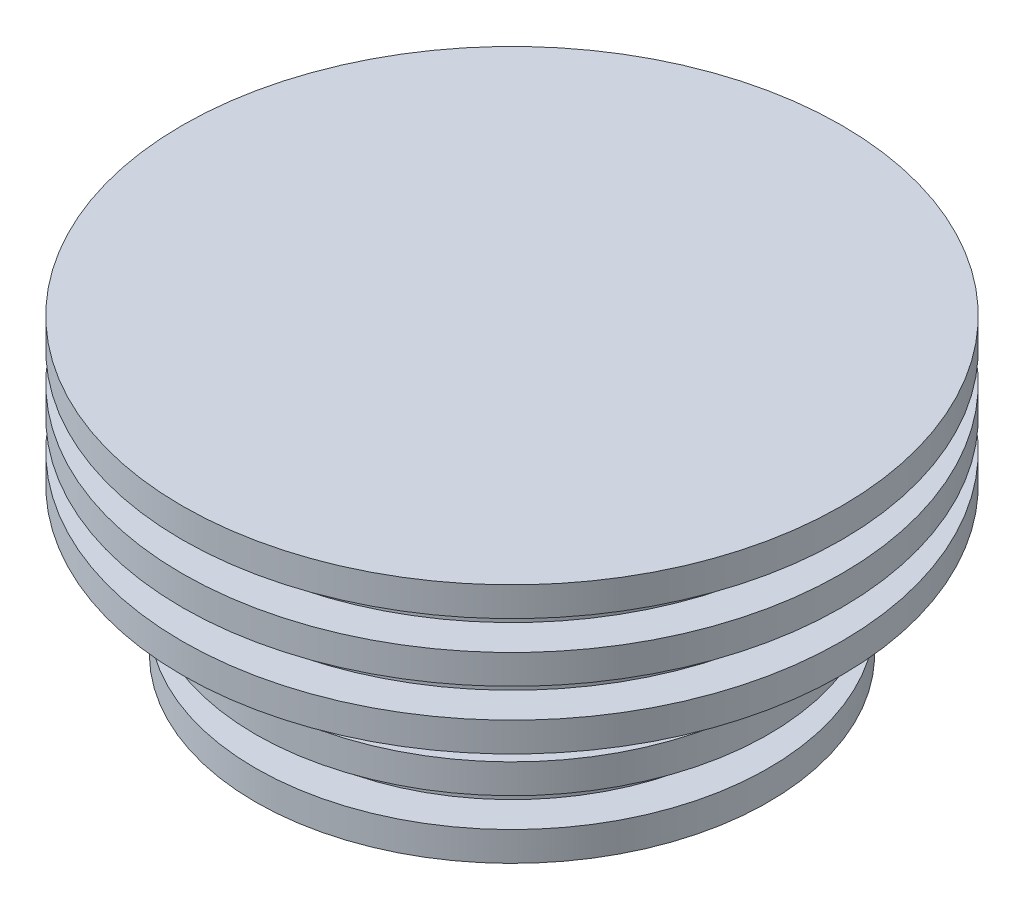
from build123d import *

# Parameters (mm, degrees)
SKETCH1_R           = 22.225
SKETCH1_R_2         = 19.05
BOSS_EXTRUDE1_DEPTH = 2.54
SKETCH3_R           = 19.05
BOSS_EXTRUDE2_DEPTH = 12.7
LPATTERN1_COUNT     = 3
LPATTERN1_PITCH     = 5.08
SKETCH5_R           = 25.4
SKETCH5_R_2         = 22.225
BOSS_EXTRUDE3_DEPTH = 12.7
SKETCH7_R           = 28.575
BOSS_EXTRUDE4_DEPTH = 2.54
LPATTERN2_COUNT     = 3
LPATTERN2_PITCH     = 5.08


with BuildPart() as part:
    # Sketch1 → Boss-Extrude1 (new body)
    with BuildSketch(Plane(origin=(0, 0, 0), x_dir=(1, 0, 0), z_dir=(0, 1, 0))):
        with Locations(Location((0, 0, 0), (0, 0, 270))):
            Circle(SKETCH1_R)
        with Locations(Location((0, 0, 0), (0, 0, 270))):
            Circle(SKETCH1_R_2, mode=Mode.SUBTRACT)
    boss_extrude1 = extrude(amount=BOSS_EXTRUDE1_DEPTH)

    # Sketch3 → Boss-Extrude2 (add)
    with BuildSketch(Plane.XZ):
        with Locations(Location((0, 0, 0), (0, 0, 270))):
            Circle(SKETCH3_R)
    extrude(amount=-BOSS_EXTRUDE2_DEPTH)

    # LPattern1: Boss-Extrude1 ×3
    with Locations(*[(0, i * LPATTERN1_PITCH, 0) for i in range(1, LPATTERN1_COUNT)]):
        add(boss_extrude1)

    # Sketch5 → Boss-Extrude3 (add)
    # profile 1 of 2: a face of its own
    with BuildSketch(Plane(origin=(0, 12.7, 0), x_dir=(1, 0, 0), z_dir=(0, 1, 0))):
        with Locations(Location((0, 0, 0), (0, 0, 270))):
            Circle(SKETCH5_R)
        with Locations(Location((0, 0, 0), (0, 0, 270))):
            Circle(SKETCH5_R_2, mode=Mode.SUBTRACT)
    # profile 2 of 2: a face of its own
    with BuildSketch(Plane(origin=(0, 12.7, 0), x_dir=(1, 0, 0), z_dir=(0, 1, 0))):
        with Locations(Location((0, 0, 0), (0, 0, 270))):
            Circle(SKETCH5_R_2)
    extrude(amount=BOSS_EXTRUDE3_DEPTH)

    # Sketch7 → Boss-Extrude4 (add)
    with BuildSketch(Plane.XZ.offset(-12.7)):
        with Locations(Location((0, 0, 0), (0, 0, 270))):
            Circle(SKETCH7_R)
    boss_extrude4 = extrude(amount=-BOSS_EXTRUDE4_DEPTH)

    # LPattern2: Boss-Extrude4 ×3
    with Locations(*[(0, i * LPATTERN2_PITCH, 0) for i in range(1, LPATTERN2_COUNT)]):
        add(boss_extrude4)


solid = part.part
